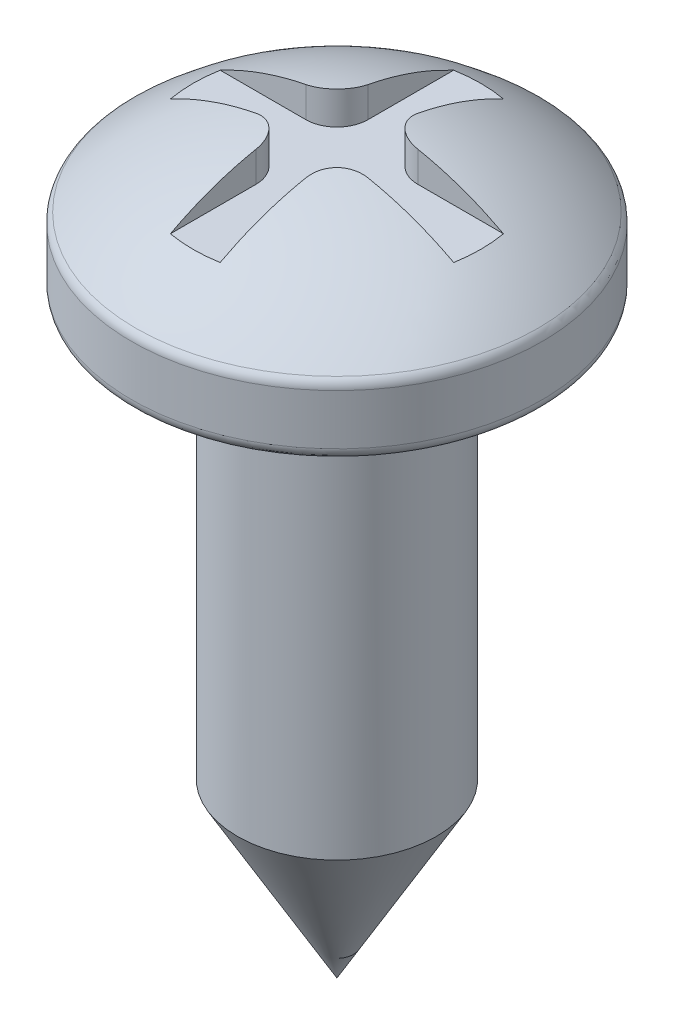
from build123d import *

# Parameters (mm, degrees)
CORTAR_EXTRUIR1_START = -1.8
CORTAR_EXTRUIR1_DEPTH = 3


with BuildPart() as part:
    # Croquis1 → Revolución1 (revolve)
    with BuildSketch(Plane.XY, mode=Mode.PRIVATE) as revoluci_n1_sk:
        with BuildLine():
            Line((0, 0), (0, 11.9))
            ThreePointArc((0, 11.9), (1.726548348, 11.569000929), (3.231811568, 10.660864252))
            ThreePointArc((3.231811568, 10.660864252), (3.282156956, 10.593022088), (3.3, 10.5104458))
            Line((3.3, 10.5104458), (3.3, 9.7))
            ThreePointArc((3.3, 9.7), (3.241421356, 9.558578644), (3.1, 9.5))
            Line((3.1, 9.5), (1.6, 9.5))
            Line((1.6, 9.5), (1.6, 2.771281292))
            Line((1.6, 2.771281292), (0, 0))
        make_face()
    revolve(revoluci_n1_sk.sketch.rotate(Axis((0, 0, 0), (0, 1, 0)), 90), axis=Axis((0, 0, 0), (0, 1, 0)))

    # Croquis2 → Cortar-Extruir1 (cut)
    with BuildSketch(Plane.XZ.offset(-9.5).offset(CORTAR_EXTRUIR1_START)):
        with BuildLine():
            Line((-0.4, 3.2), (-0.4, 0.9))
            ThreePointArc((-0.4, 0.9), (-0.546446609, 0.546446609), (-0.9, 0.4))
            Line((-0.9, 0.4), (-3.2, 0.4))
            Line((-3.2, 0.4), (-3.2, -0.4))
            Line((-3.2, -0.4), (-0.9, -0.4))
            ThreePointArc((-0.9, -0.4), (-0.546446609, -0.546446609), (-0.4, -0.9))
            Line((-0.4, -0.9), (-0.4, -3.2))
            Line((-0.4, -3.2), (0.4, -3.2))
            Line((0.4, -3.2), (0.4, -0.9))
            ThreePointArc((0.4, -0.9), (0.546446609, -0.546446609), (0.9, -0.4))
            Line((0.9, -0.4), (3.2, -0.4))
            Line((3.2, -0.4), (3.2, 0.4))
            Line((3.2, 0.4), (0.9, 0.4))
            ThreePointArc((0.9, 0.4), (0.546446609, 0.546446609), (0.4, 0.9))
            Line((0.4, 0.9), (0.4, 3.2))
            Line((0.4, 3.2), (-0.4, 3.2))
        make_face()
    extrude(amount=-CORTAR_EXTRUIR1_DEPTH, mode=Mode.SUBTRACT)


solid = part.part
